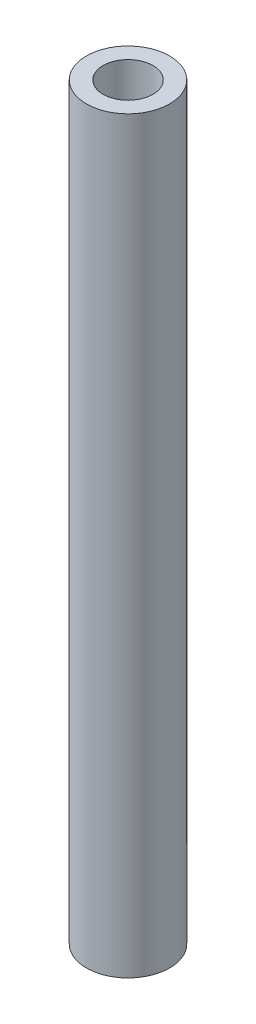
from build123d import *

# Parameters (mm, degrees)
SKETCH1_R           = 2.5
SKETCH1_R_2         = 1.5
BOSS_EXTRUDE1_DEPTH = 45


with BuildPart() as part:
    # Sketch1 → Boss-Extrude1 (new body)
    with BuildSketch(Plane(origin=(0, 0, 0), x_dir=(1, 0, 0), z_dir=(0, 1, 0))):
        with Locations(Location((0, 0, 0), (0, 0, 90))):
            Circle(SKETCH1_R)
        with Locations(Location((0, 0, 0), (0, 0, 90))):
            Circle(SKETCH1_R_2, mode=Mode.SUBTRACT)
    extrude(amount=BOSS_EXTRUDE1_DEPTH)


solid = part.part
